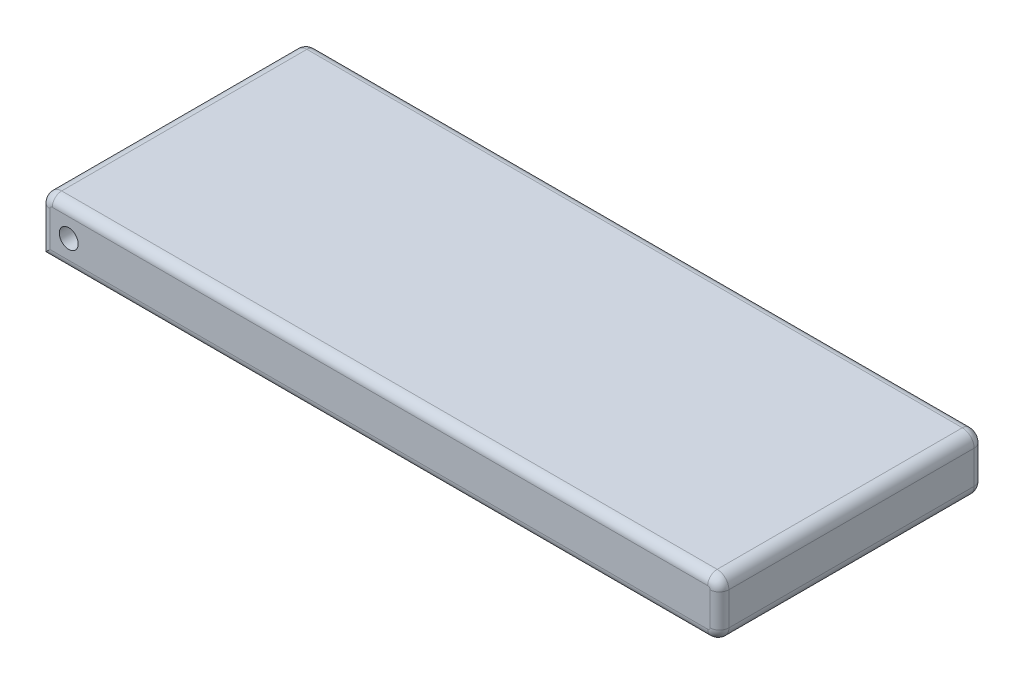
from build123d import *

# Parameters (mm, degrees)
SKETCH1_W           = 1828.8
SKETCH1_H           = 711.2
BOSS_EXTRUDE1_DEPTH = 152.4
SKETCH2_R           = 25.4
CUT_EXTRUDE1_DEPTH  = 818.642
FILLET1_R           = 31.75
FILLET2_R           = 25.4
CUT_EXTRUDE2_DEPTH  = 5.08
SCALE1_SCALE        = 0.5867


with BuildPart() as part:
    # Sketch1 → Boss-Extrude1 (new body)
    with BuildSketch(Plane(origin=(0, 0, 0), x_dir=(1, 0, 0), z_dir=(0, 1, 0))):
        Rectangle(SKETCH1_W, SKETCH1_H)
    extrude(amount=BOSS_EXTRUDE1_DEPTH)

    # Sketch2 → Cut-Extrude1 (cut)
    with BuildSketch(Plane.XY.offset(355.6)):
        with Locations((-838.2, 76.2)):
            Circle(SKETCH2_R)
    extrude(amount=-CUT_EXTRUDE1_DEPTH, mode=Mode.SUBTRACT)

    # Fillet1
    fillet1_edges = [part.edges().sort_by_distance(p)[0] for p in [
        (914.4, 152.4, 0),
        (-914.4, 152.4, 0),
        (914.4, 0, 0),
    ]]
    fillet(fillet1_edges, radius=FILLET1_R)

    # Fillet2
    fillet2_edges = [part.edges().sort_by_distance(p)[0] for p in [
        (0, 152.4, 355.6),
        (0, 152.4, -355.6),
        (-15.875, 0, -355.6),
        (-914.4, 60.325, -355.6),
        (914.4, 76.2, -355.6),
        (-905.100640303, 143.100640303, -355.6),
        (905.100640303, 9.299359697, -355.6),
        (905.100640303, 143.100640303, -355.6),
        (914.4, 76.2, 355.6),
        (-914.4, 60.325, 355.6),
        (-905.100640303, 143.100640303, 355.6),
        (905.100640303, 9.299359697, 355.6),
        (905.100640303, 143.100640303, 355.6),
        (-15.875, 0, 355.6),
    ]]
    fillet(fillet2_edges, radius=FILLET2_R)

    # Sketch3 → Cut-Extrude2 (cut)
    # profile 1 of 11: a face of its own
    with BuildSketch(Plane(origin=(0, 0, 0), x_dir=(-1, 0, 0), z_dir=(0, -1, 0))):
        Polygon((-741.04322628, 1.903335448), (-713.745349677, 1.903335448), (-641.722713459, -81.669380898), (-641.722713459, 1.903335448), (-612.415021152, 1.903335448), (-612.415021152, -125.096664552), (-639.916423395, -125.096664552), (-711.735533972, -41.778355257), (-711.735533972, -125.096664552), (-741.04322628, -125.096664552), align=None)
    # profile 2 of 11: a face of its own
    with BuildSketch(Plane(origin=(0, 0, 0), x_dir=(-1, 0, 0), z_dir=(0, -1, 0))):
        Polygon((-523.321671793, 1.903335448), (-494.751759934, 1.903335448), (-430.870149357, -125.096664552), (-462.28942019, -125.096664552), (-474.831687818, -99.045382501), (-543.241743908, -99.045382501), (-555.758570831, -125.096664552), (-587.177841665, -125.096664552), align=None)
        Polygon((-509.023995511, -32.161768718), (-532.276799998, -76.250510706), (-485.771191024, -76.250510706), align=None, mode=Mode.SUBTRACT)
    # profile 3 of 11: a face of its own
    with BuildSketch(Plane(origin=(0, 0, 0), x_dir=(-1, 0, 0), z_dir=(0, -1, 0))):
        with BuildLine():
            Line((-324.222713459, -15.065614872), (-346.737737498, -30.660767116))
            add(Edge.make_bspline(
                [(-346.737737498, -30.660767116), (-347.715185294, -29.628323957), (-349.605595267, -27.631551493), (-352.595006983, -24.969727948), (-355.598763723, -22.720644254), (-358.614521941, -20.863977824), (-361.658305777, -19.420915246), (-364.724367801, -18.400144663), (-367.801156064, -17.754785297), (-369.860332209, -17.674780577), (-370.880966665, -17.63512609)],
                knots=[0, 0, 0, 0, 1.207669291, 2.335664454, 3.396356464, 4.392421051, 5.340108823, 6.251573568, 7.133389213, 8, 8, 8, 8], degree=3))
            add(Edge.make_bspline(
                [(-370.880966665, -17.63512609), (-371.832882823, -17.660228759), (-373.665372043, -17.708552731), (-376.282288775, -18.193100225), (-378.626324578, -19.007109426), (-380.655360183, -20.112329951), (-382.291631434, -21.422401548), (-383.559284375, -22.806295535), (-384.328952264, -24.349219552), (-384.42140466, -25.429573854), (-384.466303203, -25.954236667)],
                knots=[0, 0, 0, 0, 1.308994644, 2.519884291, 3.645670017, 4.711226319, 5.682704006, 6.518200215, 7.28037937, 8, 8, 8, 8], degree=3))
            add(Edge.make_bspline(
                [(-384.466303203, -25.954236667), (-384.429171189, -26.483872774), (-384.353835284, -27.558433828), (-383.815795732, -29.137692509), (-382.933822341, -30.660479426), (-382.134596609, -31.564265848), (-381.718707049, -32.034565193)],
                knots=[0, 0, 0, 0, 0.929301116, 1.885428076, 2.899649557, 4, 4, 4, 4], degree=3))
            add(Edge.make_bspline(
                [(-381.718707049, -32.034565193), (-381.333269976, -32.404491114), (-380.439189132, -33.262591443), (-378.775669744, -34.589242033), (-376.703772958, -36.266499182), (-374.096218644, -38.133978882), (-371.077123063, -40.348543273), (-367.545537717, -42.76680579), (-363.593060645, -45.533385299), (-360.767807805, -47.423191133), (-359.280005126, -48.418379295)],
                knots=[0, 0, 0, 0, 0.460866546, 1.069051162, 1.834896047, 2.761527, 3.83612926, 5.066510405, 6.455198905, 8, 8, 8, 8], degree=3))
            add(Edge.make_bspline(
                [(-359.280005126, -48.418379295), (-357.888340349, -49.341362736), (-355.253972779, -51.088534673), (-351.524011553, -53.592321234), (-348.228619127, -55.827649193), (-345.343454281, -57.780115303), (-342.909333581, -59.488133102), (-340.889035665, -60.906840732), (-339.312991869, -62.071444273), (-338.417428108, -62.773858494), (-338.037016344, -63.072225449)],
                knots=[0, 0, 0, 0, 1.552684983, 2.939172589, 4.176976497, 5.255162841, 6.178235249, 6.941768944, 7.550491478, 8, 8, 8, 8], degree=3))
            add(Edge.make_bspline(
                [(-338.037016344, -63.072225449), (-336.584727525, -64.280331797), (-333.818103952, -66.581785513), (-330.172498362, -70.19528408), (-327.168924335, -73.715823462), (-324.824562259, -77.221419889), (-323.088785854, -80.778798378), (-321.836759811, -84.439820682), (-321.124705308, -88.273297736), (-321.019415224, -90.884600095), (-320.966303203, -92.201832821)],
                knots=[0, 0, 0, 0, 1.292881224, 2.462950635, 3.509647133, 4.456510364, 5.341962874, 6.212247473, 7.098194766, 8, 8, 8, 8], degree=3))
            add(Edge.make_bspline(
                [(-320.966303203, -92.201832821), (-320.998980048, -93.48560975), (-321.063278442, -96.011704117), (-321.765237664, -99.706218889), (-322.82176969, -103.228167658), (-324.312880846, -106.588440053), (-326.276820046, -109.745201811), (-328.61598971, -112.770205621), (-331.434074004, -115.575848048), (-334.61749926, -118.202268885), (-338.15201669, -120.588859913), (-341.975182179, -122.678082522), (-346.058135371, -124.43079597), (-350.399972962, -125.864849497), (-354.997534795, -126.967991096), (-359.849790585, -127.784879038), (-364.960036025, -128.27623414), (-368.454515358, -128.327042569), (-370.244949036, -128.353074808)],
                knots=[0, 0, 0, 0, 0.902957558, 1.77675416, 2.638138365, 3.488188074, 4.356663338, 5.250152695, 6.174883614, 7.150484739, 8.152501359, 9.173326986, 10.213821441, 11.276962312, 12.389277065, 13.539836655, 14.739509126, 16, 16, 16, 16], degree=3))
            add(Edge.make_bspline(
                [(-370.244949036, -128.353074808), (-371.653240478, -128.334277324), (-374.422338556, -128.297316169), (-378.507106757, -127.983283346), (-382.456522462, -127.478498723), (-386.27196177, -126.770837843), (-389.950058733, -125.851042984), (-393.487795541, -124.737684993), (-396.884988335, -123.406229712), (-400.155692315, -121.881706063), (-403.29334308, -120.120914227), (-406.305369798, -118.122988534), (-409.209113236, -115.911227546), (-411.996534339, -113.453254634), (-414.655206283, -110.758356641), (-417.215178272, -107.838879177), (-419.661664419, -104.691866972), (-421.157108257, -102.447223517), (-421.915021152, -101.309605257)],
                knots=[0, 0, 0, 0, 1.105273542, 2.173279444, 3.213565855, 4.229263474, 5.217276341, 6.187756421, 7.138309119, 8.079281442, 9.018038101, 9.95957529, 10.914128178, 11.880948991, 12.874083274, 13.883479761, 14.927316466, 16, 16, 16, 16], degree=3))
            Line((-421.915021152, -101.309605257), (-395.965501921, -89.276151731))
            add(Edge.make_bspline(
                [(-395.965501921, -89.276151731), (-394.998057606, -90.56867087), (-393.123958498, -93.072493496), (-389.998658476, -96.372834435), (-386.811826199, -99.22927796), (-383.467225161, -101.517006719), (-380.027095556, -103.340552949), (-376.463461014, -104.613660429), (-372.790651114, -105.414300631), (-370.299845224, -105.510102054), (-369.049235895, -105.558203013)],
                knots=[0, 0, 0, 0, 1.183126636, 2.291911316, 3.327479545, 4.315960281, 5.256209658, 6.174923512, 7.083646907, 8, 8, 8, 8], degree=3))
            add(Edge.make_bspline(
                [(-369.049235895, -105.558203013), (-367.773525738, -105.518310603), (-365.304056438, -105.441088451), (-361.769712089, -104.732596167), (-358.529152897, -103.634954957), (-355.720939277, -102.026330437), (-353.349050987, -100.193153645), (-351.5891345, -98.139141348), (-350.459457793, -95.892671059), (-350.335367266, -94.308323922), (-350.273995511, -93.524749488)],
                knots=[0, 0, 0, 0, 1.250982055, 2.421601618, 3.52480127, 4.59457637, 5.583980509, 6.452687854, 7.234742052, 8, 8, 8, 8], degree=3))
            add(Edge.make_bspline(
                [(-350.273995511, -93.524749488), (-350.324620126, -92.797252283), (-350.42856222, -91.303560281), (-351.264108278, -89.107492113), (-352.532888459, -86.91100873), (-354.024349373, -85.128486698), (-355.557493595, -83.652380162), (-357.016434243, -82.342664143), (-358.795386599, -80.905777428), (-360.890946926, -79.330798765), (-363.282098161, -77.611687568), (-365.953174707, -75.712030544), (-368.962920146, -73.71658801), (-371.075063933, -72.339624636), (-372.178442626, -71.620302372)],
                knots=[0, 0, 0, 0, 0.815327801, 1.67402515, 2.608680218, 3.657665297, 4.270694342, 4.999323204, 5.859287847, 6.838608332, 7.943834011, 9.167558269, 10.52033944, 12, 12, 12, 12], degree=3))
            add(Edge.make_bspline(
                [(-372.178442626, -71.620302372), (-374.277337576, -70.252992792), (-378.299737213, -67.63263032), (-384.007272424, -63.767778851), (-389.126859105, -60.135125624), (-393.657266063, -56.732953204), (-397.606218852, -53.57185105), (-401.010934534, -50.699631668), (-403.79193134, -48.018003022), (-406.079633299, -45.559392737), (-407.909070231, -43.187425254), (-409.494656817, -40.893282751), (-410.771095335, -38.565173802), (-411.898660742, -36.27393798), (-412.733204053, -33.959800796), (-413.32119516, -31.650174583), (-413.694409876, -29.349914575), (-413.747559213, -27.812761589), (-413.773995511, -27.048186988)],
                knots=[0, 0, 0, 0, 1.89919295, 3.639683364, 5.225705325, 6.658205857, 7.934446372, 9.060714954, 10.033806128, 10.862042785, 11.604144816, 12.303191233, 12.973898893, 13.615209792, 14.237579864, 14.834833964, 15.420450427, 16, 16, 16, 16], degree=3))
            add(Edge.make_bspline(
                [(-413.773995511, -27.048186988), (-413.734727711, -25.959807534), (-413.657146733, -23.809507763), (-413.041750309, -20.649951563), (-412.09183194, -17.59093211), (-410.657410992, -14.689084292), (-408.890336557, -11.879613853), (-406.709003509, -9.210799104), (-404.146488824, -6.650554719), (-401.209621491, -4.267944782), (-397.999225381, -2.06279947), (-394.561764487, -0.125082013), (-390.928680835, 1.500982863), (-387.129651953, 2.858371306), (-383.145224463, 3.899293262), (-378.976788181, 4.635563535), (-374.621479975, 5.068717918), (-371.653642348, 5.129043503), (-370.143186216, 5.159745705)],
                knots=[0, 0, 0, 0, 0.869527605, 1.71791649, 2.564868322, 3.423034978, 4.29767548, 5.213596993, 6.172427456, 7.188991251, 8.232708049, 9.283076077, 10.339096273, 11.411315699, 12.504907975, 13.627395035, 14.792482552, 16, 16, 16, 16], degree=3))
            add(Edge.make_bspline(
                [(-370.143186216, 5.159745705), (-368.181364, 5.105311084), (-364.291631647, 4.997382801), (-358.541259997, 4.153127625), (-352.931688906, 2.808817436), (-348.371146912, 1.205575007), (-344.747009968, -0.377581522), (-341.970303949, -1.808274165), (-339.150835728, -3.481556704), (-336.238017406, -5.317728554), (-333.325301402, -7.460790612), (-330.315005518, -9.765263553), (-327.260739895, -12.312910991), (-325.250880838, -14.134009966), (-324.222713459, -15.065614872)],
                knots=[0, 0, 0, 0, 1.370666987, 2.717640612, 4.053103165, 5.397100452, 6.08976297, 6.816069123, 7.578454649, 8.38077928, 9.221355996, 10.104544732, 11.030357245, 12, 12, 12, 12], degree=3))
        make_face()
    # profile 4 of 11: a face of its own
    with BuildSketch(Plane(origin=(0, 0, 0), x_dir=(-1, 0, 0), z_dir=(0, -1, 0))):
        Polygon((-240.013979485, 1.903335448), (-211.444067626, 1.903335448), (-147.562457049, -125.096664552), (-178.981727883, -125.096664552), (-191.523995511, -99.045382501), (-259.9340516, -99.045382501), (-272.450878524, -125.096664552), (-303.870149357, -125.096664552), align=None)
        Polygon((-225.716303203, -32.161768718), (-248.96910769, -76.250510706), (-202.463498716, -76.250510706), align=None, mode=Mode.SUBTRACT)
    # profile 5 of 11: a face of its own
    with BuildSketch(Plane(origin=(0, 0, 0), x_dir=(-1, 0, 0), z_dir=(0, -1, 0))):
        Polygon((-62.081687818, 1.903335448), (16.072158335, 1.903335448), (16.072158335, -20.891536347), (-32.773995511, -20.891536347), (-32.773995511, -45.31461327), (16.072158335, -45.31461327), (16.072158335, -68.109485065), (-32.773995511, -68.109485065), (-32.773995511, -125.096664552), (-62.081687818, -125.096664552), align=None)
    # profile 6 of 11: a face of its own
    with BuildSketch(Plane(origin=(0, 0, 0), x_dir=(-1, 0, 0), z_dir=(0, -1, 0))):
        Polygon((45.379850643, 1.903335448), (74.687542951, 1.903335448), (74.687542951, -102.301792757), (121.905491669, -102.301792757), (121.905491669, -125.096664552), (45.379850643, -125.096664552), align=None)
    # profile 7 of 11: a face of its own
    with BuildSketch(Plane(origin=(0, 0, 0), x_dir=(-1, 0, 0), z_dir=(0, -1, 0))):
        Polygon((144.700363464, 1.903335448), (232.623440387, 1.903335448), (232.623440387, -20.891536347), (174.008055771, -20.891536347), (174.008055771, -45.31461327), (232.623440387, -45.31461327), (232.623440387, -68.109485065), (174.008055771, -68.109485065), (174.008055771, -102.301792757), (232.623440387, -102.301792757), (232.623440387, -125.096664552), (144.700363464, -125.096664552), align=None)
    # profile 8 of 11: a face of its own
    with BuildSketch(Plane(origin=(0, 0, 0), x_dir=(-1, 0, 0), z_dir=(0, -1, 0))):
        Polygon((252.670716028, 1.903335448), (287.600804169, 1.903335448), (321.436941989, -38.878114872), (355.349401925, 1.903335448), (390.330371476, 1.903335448), (338.914706412, -59.917578013), (393.001645515, -125.096664552), (358.071557374, -125.096664552), (321.411501284, -80.931600449), (284.675123079, -125.096664552), (249.719594233, -125.096664552), (303.959177566, -59.892137308), align=None)
    # profile 9 of 11: a face of its own
    with BuildSketch(Plane(origin=(0, 0, 0), x_dir=(-1, 0, 0), z_dir=(0, -1, 0))):
        with BuildLine():
            Line((414.982414746, -125.096664552), (414.982414746, 1.903335448))
            Line((414.982414746, 1.903335448), (440.423119874, 1.903335448))
            add(Edge.make_bspline(
                [(440.423119874, 1.903335448), (442.204075346, 1.903599735), (445.647777849, 1.904110766), (450.625903275, 1.763011696), (455.230836119, 1.585857148), (459.465992934, 1.378442614), (463.323732551, 1.035601354), (466.820605897, 0.664091574), (469.947601857, 0.224427878), (471.89486749, -0.173877189), (472.809137502, -0.360887308)],
                knots=[0, 0, 0, 0, 1.31441287, 2.541583415, 3.675316184, 4.715842416, 5.670689375, 6.533301982, 7.31136359, 8, 8, 8, 8], degree=3))
            add(Edge.make_bspline(
                [(472.809137502, -0.360887308), (473.991924737, -0.625078844), (476.316632935, -1.144333881), (479.675148067, -2.177408077), (482.856651187, -3.337550449), (485.853423237, -4.663015689), (488.660931296, -6.166505864), (491.280970273, -7.842389264), (493.708645374, -9.685909182), (495.945967041, -11.658890376), (497.956306612, -13.768563287), (499.71909026, -15.977424901), (501.204019995, -18.28987271), (502.449844152, -20.679925061), (503.344000295, -23.198586435), (504.052464449, -25.778186279), (504.467569473, -28.467879417), (504.511457156, -30.294726364), (504.533696797, -31.220462629)],
                knots=[0, 0, 0, 0, 1.21039384, 2.378967575, 3.507448572, 4.592210469, 5.649765234, 6.686203795, 7.696123764, 8.692411738, 9.663229168, 10.604006275, 11.511144131, 12.405371171, 13.289913155, 14.175671563, 15.075539964, 16, 16, 16, 16], degree=3))
            add(Edge.make_bspline(
                [(504.533696797, -31.220462629), (504.492554669, -32.411220876), (504.411266016, -34.763922089), (503.676972496, -38.204578893), (502.460038006, -41.46792677), (500.795155039, -44.59689866), (498.544802103, -47.560723179), (495.742994382, -50.42215972), (492.328739512, -53.171245918), (489.769091817, -54.827676843), (488.429730451, -55.694420962)],
                knots=[0, 0, 0, 0, 0.928134894, 1.833809755, 2.729717939, 3.63843239, 4.588473462, 5.622436005, 6.755915759, 8, 8, 8, 8], degree=3))
            add(Edge.make_bspline(
                [(488.429730451, -55.694420962), (489.587786706, -56.149487084), (491.8408098, -57.03482791), (495.049821466, -58.514732451), (498.024524078, -60.072852843), (500.763900743, -61.715246045), (503.265749747, -63.444938986), (505.525478116, -65.258128821), (507.536116227, -67.16967423), (509.328476124, -69.156279437), (510.891039996, -71.235440914), (512.255091563, -73.397103984), (513.357760497, -75.679869312), (514.327460249, -78.021547977), (515.015951597, -80.478014069), (515.571483539, -83.005251157), (515.872415223, -85.639298027), (515.911352188, -87.426780348), (515.931132694, -88.334845642)],
                knots=[0, 0, 0, 0, 1.30357085, 2.536124836, 3.70072561, 4.820812461, 5.880737971, 6.88547818, 7.853434119, 8.784721415, 9.685757567, 10.575860977, 11.458078734, 12.339221816, 13.227815898, 14.127097695, 15.048540195, 16, 16, 16, 16], degree=3))
            add(Edge.make_bspline(
                [(515.931132694, -88.334845642), (515.913590528, -89.209342529), (515.878717979, -90.947778609), (515.536302795, -93.528303564), (514.975191646, -96.04563062), (514.204841078, -98.515134575), (513.22023939, -100.917221898), (512.001406477, -103.260174533), (510.58555471, -105.549591528), (508.368871006, -108.484249268), (505.23720812, -111.906072662), (500.921138698, -115.474045243), (496.085106343, -118.462980411), (491.673833627, -120.495746236), (487.845037502, -121.84969449), (484.665387489, -122.692663328), (481.244126424, -123.477439736), (477.532123276, -124.028316161), (473.573490327, -124.529925381), (469.344634323, -124.841023875), (464.856824853, -125.051639819), (461.776623287, -125.081360568), (460.190547759, -125.096664552)],
                knots=[0, 0, 0, 0, 0.702345849, 1.396212362, 2.08722931, 2.772545451, 3.472275354, 4.170144977, 4.892403068, 5.632378178, 7.122473461, 8.608200326, 10.116997227, 11.677927357, 12.501123786, 13.377214847, 14.319510684, 15.319857259, 16.390657971, 17.525204543, 18.72566375, 20, 20, 20, 20], degree=3))
            Line((460.190547759, -125.096664552), (414.982414746, -125.096664552))
        make_face()
        with BuildLine():
            Line((444.290107053, -20.891536347), (444.290107053, -48.571023526))
            Line((444.290107053, -48.571023526), (451.489826605, -48.571023526))
            add(Edge.make_bspline(
                [(451.489826605, -48.571023526), (452.465350301, -48.563908447), (454.3503379, -48.550160103), (457.076329011, -48.370479117), (459.608728416, -48.071693704), (461.943200287, -47.636819637), (464.091615238, -47.11571774), (466.041513176, -46.451333292), (467.796227667, -45.667644921), (469.364942398, -44.772372241), (470.747050985, -43.776061443), (471.960611017, -42.688945083), (472.939130907, -41.471221129), (473.813218286, -40.227611061), (474.443647525, -38.85381505), (474.909964773, -37.403255553), (475.156185382, -35.858843641), (475.202445428, -34.808341297), (475.226004489, -34.273347244)],
                knots=[0, 0, 0, 0, 1.50694, 2.911834152, 4.218410663, 5.444186107, 6.578612203, 7.631009277, 8.622083953, 9.543507929, 10.416232427, 11.250851825, 12.051030307, 12.825037802, 13.592810382, 14.375967611, 15.172921721, 16, 16, 16, 16], degree=3))
            add(Edge.make_bspline(
                [(475.226004489, -34.273347244), (475.216296836, -33.771529691), (475.197211179, -32.78493513), (474.900761121, -31.358934494), (474.457727592, -30.014993712), (473.890172614, -28.727028814), (473.068062404, -27.549529211), (472.112416305, -26.432434294), (470.970976988, -25.405282535), (469.670602825, -24.460238455), (468.182982414, -23.622699555), (466.513800032, -22.881640237), (464.665871403, -22.254766317), (462.633439593, -21.740455447), (460.427614111, -21.376067693), (458.042261717, -21.095818263), (455.478413572, -20.911607735), (453.703497867, -20.8983697), (452.787302566, -20.891536347)],
                knots=[0, 0, 0, 0, 0.822126235, 1.616334996, 2.37767588, 3.143581807, 3.915532466, 4.724598826, 5.552125348, 6.428966749, 7.357616917, 8.348125827, 9.421942663, 10.556019641, 11.784606864, 13.087850433, 14.496774951, 16, 16, 16, 16], degree=3))
            Line((452.787302566, -20.891536347), (444.290107053, -20.891536347))
        make_face(mode=Mode.SUBTRACT)
        with BuildLine():
            Line((444.290107053, -69.737690193), (444.290107053, -102.301792757))
            Line((444.290107053, -102.301792757), (452.405691989, -102.301792757))
            add(Edge.make_bspline(
                [(452.405691989, -102.301792757), (454.017086678, -102.294597838), (457.10529153, -102.280808924), (461.534910569, -102.106594406), (465.556059611, -101.799251432), (469.166804983, -101.411253291), (472.370827253, -100.881832202), (475.159825588, -100.230462351), (477.554193904, -99.484430736), (479.562889099, -98.585784817), (481.229591075, -97.542060687), (482.688384036, -96.453738211), (483.897728674, -95.211945108), (484.89099101, -93.867642102), (485.67266029, -92.411390671), (486.232708106, -90.853025625), (486.573942185, -89.180695434), (486.606712792, -88.031183611), (486.623440387, -87.444420962)],
                knots=[0, 0, 0, 0, 1.863677021, 3.571698765, 5.125870657, 6.527460233, 7.770677037, 8.879316776, 9.837772239, 10.667369784, 11.415954499, 12.108463737, 12.767373067, 13.412784922, 14.035900443, 14.671928085, 15.322092231, 16, 16, 16, 16], degree=3))
            add(Edge.make_bspline(
                [(486.623440387, -87.444420962), (486.599742835, -86.772824959), (486.553441361, -85.460626752), (486.167160109, -83.543034749), (485.485474521, -81.75696565), (484.605054268, -80.047934394), (483.401906669, -78.499741399), (481.992431839, -77.022788819), (480.294131529, -75.684319149), (478.349882349, -74.429095047), (476.106157684, -73.294231646), (473.517535975, -72.33969497), (470.595719559, -71.538658506), (467.329843863, -70.885158962), (463.739795629, -70.347415995), (459.79678119, -70.016230136), (455.520950011, -69.774215667), (452.550253577, -69.75018063), (451.006453207, -69.737690193)],
                knots=[0, 0, 0, 0, 0.728905048, 1.424171514, 2.111773536, 2.799683775, 3.503194317, 4.232564524, 5.012006625, 5.844676325, 6.742418903, 7.736096524, 8.835274342, 10.028973867, 11.350762681, 12.774676528, 14.323876007, 16, 16, 16, 16], degree=3))
            Line((451.006453207, -69.737690193), (444.290107053, -69.737690193))
        make_face(mode=Mode.SUBTRACT)
    # profile 10 of 11: a face of its own
    with BuildSketch(Plane(origin=(0, 0, 0), x_dir=(-1, 0, 0), z_dir=(0, -1, 0))):
        Polygon((545.238825002, 1.903335448), (633.161901925, 1.903335448), (633.161901925, -20.891536347), (574.54651731, -20.891536347), (574.54651731, -45.31461327), (633.161901925, -45.31461327), (633.161901925, -68.109485065), (574.54651731, -68.109485065), (574.54651731, -102.301792757), (633.161901925, -102.301792757), (633.161901925, -125.096664552), (545.238825002, -125.096664552), align=None)
    # profile 11 of 11: a face of its own
    with BuildSketch(Plane(origin=(0, 0, 0), x_dir=(-1, 0, 0), z_dir=(0, -1, 0))):
        with BuildLine():
            Line((662.469594233, 1.903335448), (699.053328207, 1.903335448))
            add(Edge.make_bspline(
                [(699.053328207, 1.903335448), (701.911539168, 1.88771243), (707.434983995, 1.857521209), (715.435163978, 1.516611784), (722.859901672, 0.994747263), (729.719936184, 0.27084506), (736.01368487, -0.683290978), (741.746238159, -1.874399217), (746.918356325, -3.255194259), (751.584013625, -4.869244407), (755.841420062, -6.775585892), (759.877189632, -8.873543176), (763.698485102, -11.2851242), (767.353706365, -13.934077645), (770.819579403, -16.862836541), (774.077074551, -20.076522031), (777.133759494, -23.554070054), (780.008211055, -27.253869034), (782.620252766, -31.171366159), (784.902687906, -35.285510209), (786.799519979, -39.575915272), (788.406815738, -44.012469941), (789.570373087, -48.639397634), (790.487110942, -53.39986919), (790.9897332, -58.33791068), (791.061408226, -61.680434289), (791.097799361, -63.377513911)],
                knots=[0, 0, 0, 0, 1.604235497, 3.100158239, 4.49367023, 5.781531563, 6.971085896, 8.065204434, 9.066323511, 9.974088253, 10.832923402, 11.682461386, 12.52507682, 13.366737129, 14.214513027, 15.069461246, 15.932795907, 16.811594352, 17.697441837, 18.573102098, 19.448852917, 20.328102441, 21.218236558, 22.123814679, 23.047415592, 24, 24, 24, 24], degree=3))
            add(Edge.make_bspline(
                [(791.097799361, -63.377513911), (791.076575603, -64.590693956), (791.034665353, -66.986343243), (790.750977633, -70.54611045), (790.270091683, -74.029431616), (789.584716827, -77.445876199), (788.686088887, -80.780264114), (787.61899225, -84.054507326), (786.347943388, -87.246809658), (784.898930427, -90.358020044), (783.261647789, -93.356449574), (781.497207304, -96.256807398), (779.547223287, -99.002246847), (777.488843517, -101.644991099), (775.251490025, -104.125456728), (772.864969013, -106.477319769), (770.359080531, -108.722773211), (766.800962544, -111.476774141), (762.158669267, -114.583732132), (756.312606316, -117.736058383), (750.22563231, -120.244090524), (744.887804508, -121.815207529), (740.246138074, -122.807599083), (736.162817239, -123.383136856), (731.507001154, -123.925533214), (726.261544844, -124.334612154), (720.427645809, -124.707393992), (714.004962235, -124.906075353), (707.000189519, -125.073763824), (702.140263288, -125.088829933), (699.61302372, -125.096664552)],
                knots=[0, 0, 0, 0, 0.8099888, 1.599473302, 2.382597465, 3.156559558, 3.924304152, 4.687063475, 5.454599256, 6.21704329, 6.977107937, 7.734552975, 8.482285685, 9.224207749, 9.969965621, 10.710655166, 11.460635414, 12.214963162, 13.713095148, 15.184899555, 16.642234991, 18.100560009, 18.893448175, 19.80950999, 20.852463786, 22.022809516, 23.321838089, 24.755240977, 26.312673279, 28, 28, 28, 28], degree=3))
            Line((699.61302372, -125.096664552), (662.469594233, -125.096664552))
            Line((662.469594233, -125.096664552), (662.469594233, 1.903335448))
        make_face()
        with BuildLine():
            Line((691.777286541, -20.891536347), (691.777286541, -102.301792757))
            Line((691.777286541, -102.301792757), (706.812743271, -102.301792757))
            add(Edge.make_bspline(
                [(706.812743271, -102.301792757), (708.60243323, -102.298998661), (712.055893495, -102.293607058), (717.04153064, -102.057093319), (721.652955687, -101.818304272), (725.874914159, -101.363184472), (729.721151878, -100.868961503), (733.165775309, -100.150170893), (736.259815749, -99.43042886), (738.99802181, -98.487578253), (741.498856588, -97.426359995), (743.834471409, -96.203594916), (746.065998917, -94.822859608), (748.174202498, -93.272485039), (750.163549954, -91.553980238), (752.059387441, -89.699666566), (753.81618827, -87.64723408), (755.455992445, -85.446382924), (756.981351124, -83.115878448), (758.231396922, -80.60708496), (759.340842299, -77.994494961), (760.261672899, -75.251584819), (760.942267615, -72.36260678), (761.416758685, -69.342859803), (761.734941475, -66.199703909), (761.771550284, -64.056724864), (761.790107053, -62.970462629)],
                knots=[0, 0, 0, 0, 1.661013709, 3.205161215, 4.632576573, 5.946121296, 7.146195225, 8.22992671, 9.211246897, 10.092461014, 10.914182661, 11.731026008, 12.537063922, 13.347892309, 14.157305669, 14.975551193, 15.807167137, 16.662040557, 17.522369097, 18.388404628, 19.259754294, 20.155889942, 21.070436805, 22.011267277, 22.991924229, 24, 24, 24, 24], degree=3))
            add(Edge.make_bspline(
                [(761.790107053, -62.970462629), (761.750158626, -61.305721865), (761.672114486, -58.053447144), (760.945068671, -53.315951181), (759.746931083, -48.862966433), (758.098014797, -44.683101786), (755.942469111, -40.813717073), (753.307580461, -37.245587843), (750.232759627, -33.92493266), (747.841607723, -32.03000855), (746.627446797, -31.067818398)],
                knots=[0, 0, 0, 0, 1.087353585, 2.124278238, 3.123124808, 4.095626576, 5.053218404, 6.008691095, 6.988868311, 8, 8, 8, 8], degree=3))
            add(Edge.make_bspline(
                [(746.627446797, -31.067818398), (745.425831362, -30.237777109), (742.939835915, -28.520523147), (738.684030257, -26.507127185), (733.964329202, -24.741022912), (728.71183101, -23.338090888), (722.957551291, -22.221706871), (716.683234783, -21.46053243), (709.899151787, -20.96260791), (705.202464855, -20.915801237), (702.767671156, -20.891536347)],
                knots=[0, 0, 0, 0, 0.765282545, 1.583276036, 2.461966267, 3.407687705, 4.432321212, 5.535733439, 6.722507848, 8, 8, 8, 8], degree=3))
            Line((702.767671156, -20.891536347), (691.777286541, -20.891536347))
        make_face(mode=Mode.SUBTRACT)
    extrude(amount=-CUT_EXTRUDE2_DEPTH, mode=Mode.SUBTRACT)


with BuildPart() as part_1:
    # Scale1: scaled about (5.599863919, 76.314673025, -0.144090727)
    add(part.part.scale(SCALE1_SCALE).moved(Location((2.314423758, 31.540854361, -0.059552697))))


solid = part_1.part
